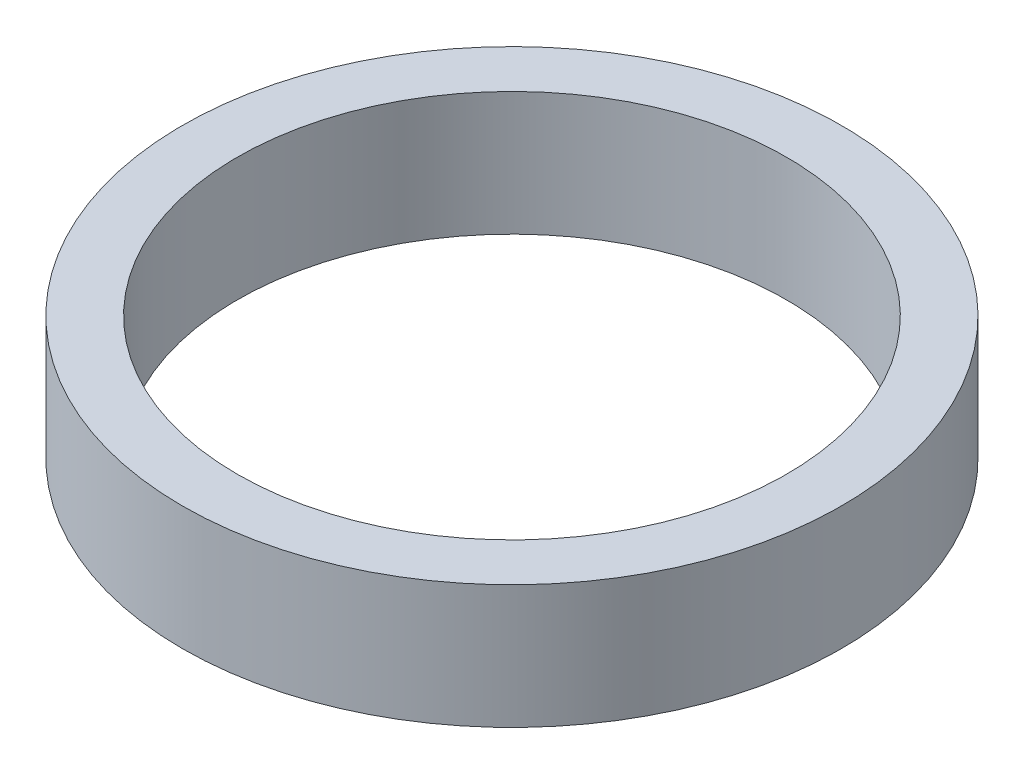
from build123d import *

# Parameters (mm, degrees)
SKETCH_1_R      = 24
SKETCH_1_R_2    = 20
EXTRUDE_2_DEPTH = 9


with BuildPart() as part:
    # 草图1 → 凸台-拉伸2 (new body)
    with BuildSketch(Plane(origin=(0, 0, 0), x_dir=(1, 0, 0), z_dir=(0, 1, 0))):
        with Locations(Location((0, 0, 0), (0, 0, 270))):
            Circle(SKETCH_1_R)
        with Locations(Location((0, 0, 0), (0, 0, 270))):
            Circle(SKETCH_1_R_2, mode=Mode.SUBTRACT)
    extrude(amount=EXTRUDE_2_DEPTH)


solid = part.part
